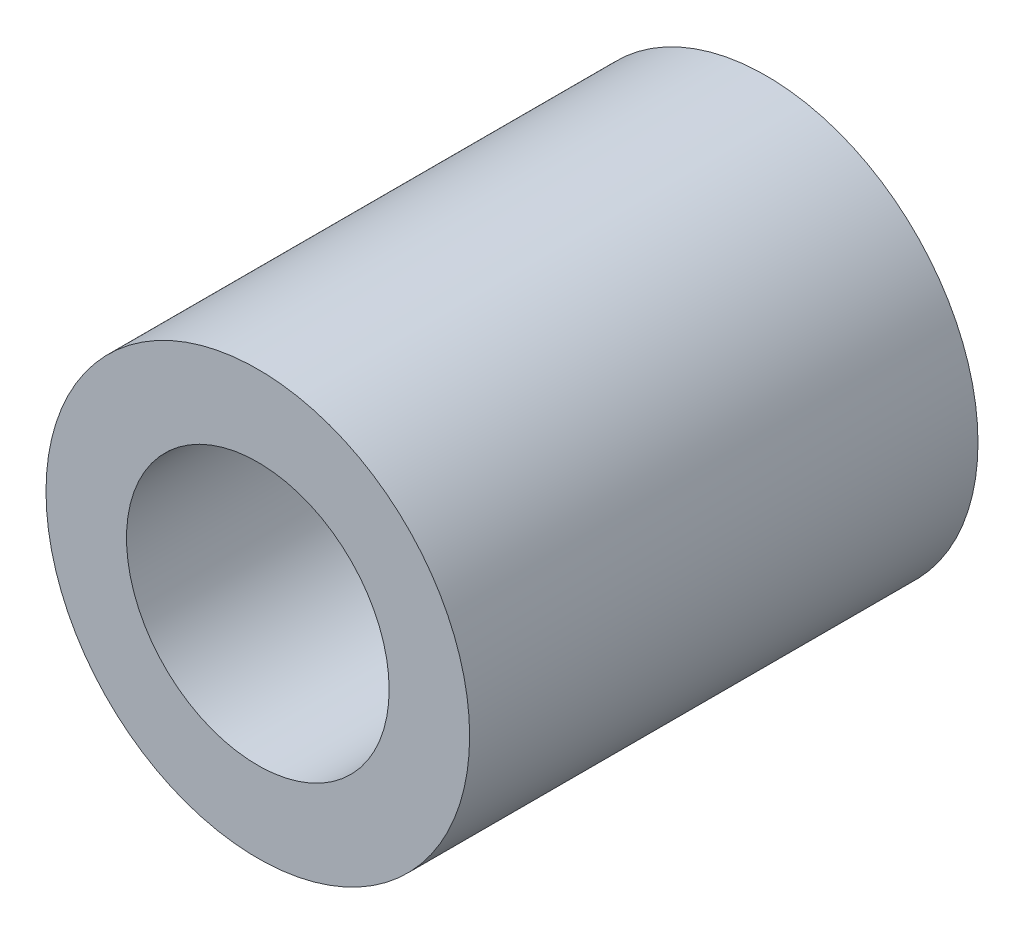
from build123d import *

# Parameters (mm, degrees)
SZKIC1_R                    = 2.5
SZKIC1_R_2                  = 1.55
DODANIE_WYCI_GNI_CIE1_DEPTH = 6


with BuildPart() as part:
    # Szkic1 → Dodanie-wyciągnięcie1 (new body)
    with BuildSketch(Plane.XY):
        with Locations((-115.185656495, 88.596041137)):
            Circle(SZKIC1_R)
        with Locations((-115.185656495, 88.596041137)):
            Circle(SZKIC1_R_2, mode=Mode.SUBTRACT)
    extrude(amount=DODANIE_WYCI_GNI_CIE1_DEPTH)


solid = part.part
